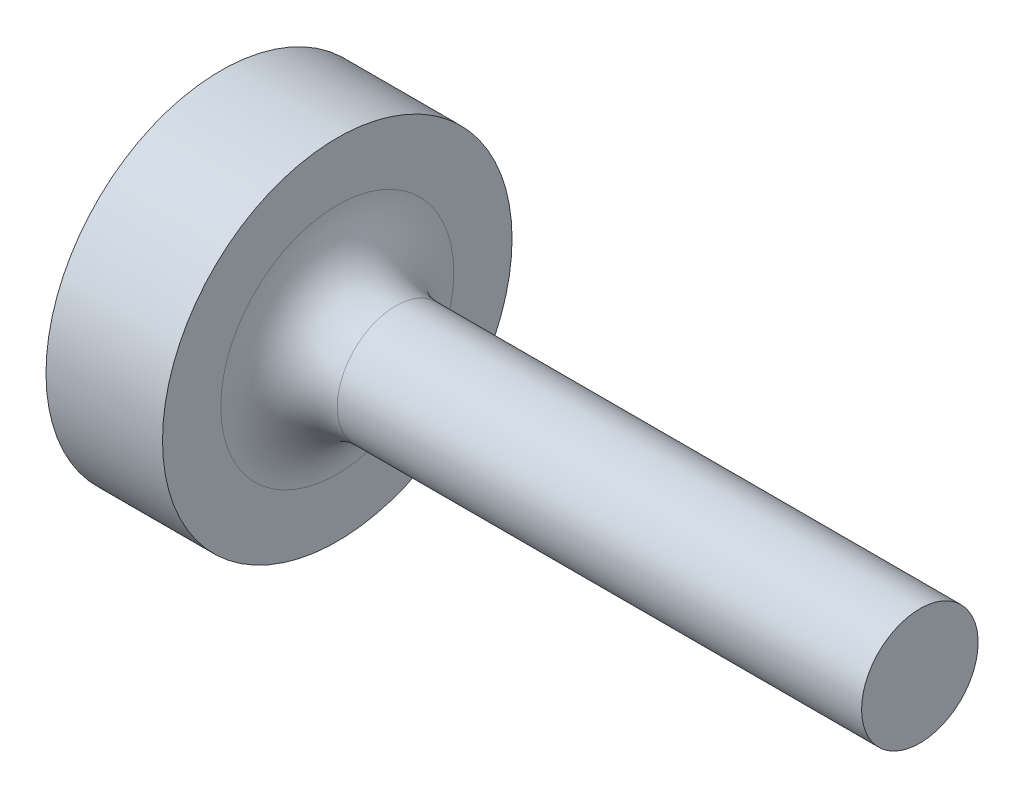
from build123d import *


with BuildPart() as part:
    # Sketch1 → Revolve1 (revolve)
    with BuildSketch(Plane.XY, mode=Mode.PRIVATE) as revolve1_sk:
        with BuildLine():
            Line((-2, 0), (10, 0))
            Line((10, 0), (10, 1))
            Line((10, 1), (1, 1))
            ThreePointArc((1, 1), (0.292893219, 1.292893219), (0, 2))
            Line((0, 2), (0, 3))
            Line((0, 3), (-2, 3))
            Line((-2, 3), (-2, 0))
        make_face()
    revolve(revolve1_sk.sketch.rotate(Axis((-2, 0, 0), (1, 0, 0)), 90), axis=Axis((-2, 0, 0), (1, 0, 0)))


solid = part.part
